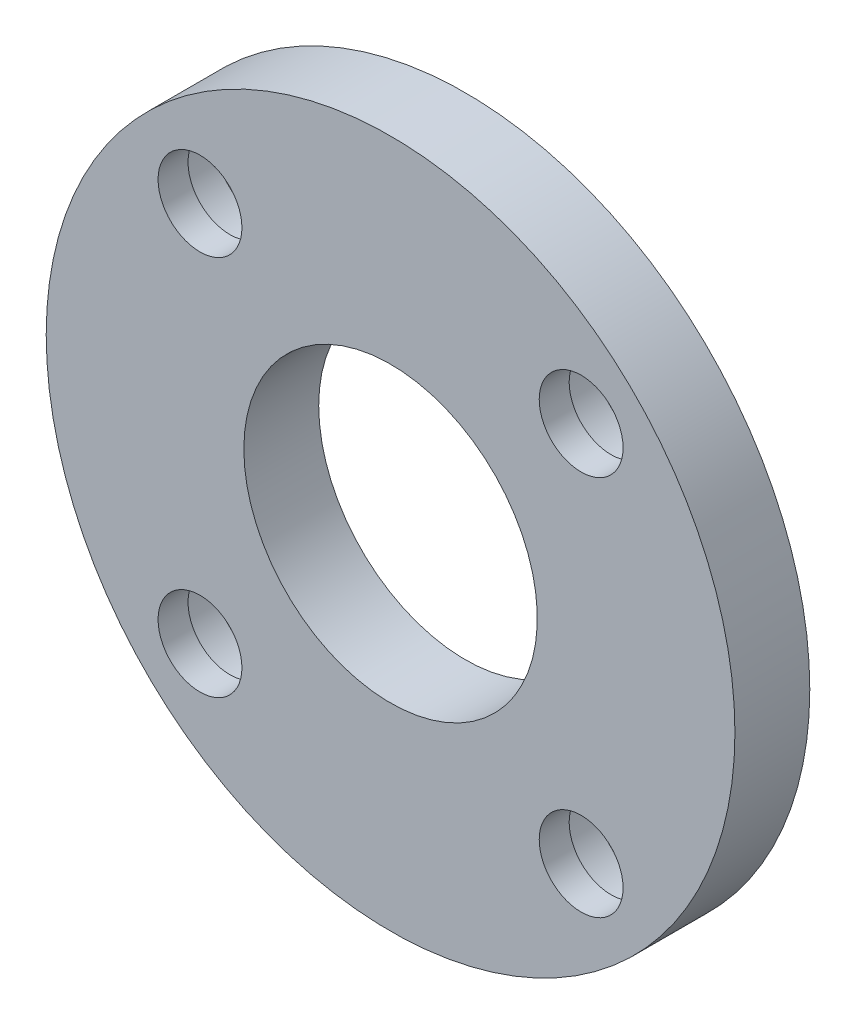
from build123d import *

# Parameters (mm, degrees)
SCHIZZO2_R                   = 23
SCHIZZO2_R_2                 = 2.8
ESTRUSIONE_ESTRUSIONE3_DEPTH = 5
SCHIZZO5_R                   = 4.3
TAGLIO_ESTRUSIONE1_DEPTH     = 3
SCHIZZO6_R                   = 9.8
TAGLIO_ESTRUSIONE2_DEPTH     = 33.908965344


with BuildPart() as part:
    # Schizzo2 → Estrusione-Estrusione3 (new body)
    with BuildSketch(Plane.XY):
        Circle(SCHIZZO2_R)
        with Locations((-12.727922061, 12.727922061)):
            Circle(SCHIZZO2_R_2, mode=Mode.SUBTRACT)
        with Locations((12.727922061, 12.727922061)):
            Circle(SCHIZZO2_R_2, mode=Mode.SUBTRACT)
        with Locations((12.727922061, -12.727922061)):
            Circle(SCHIZZO2_R_2, mode=Mode.SUBTRACT)
        with Locations((-12.727922061, -12.727922061)):
            Circle(SCHIZZO2_R_2, mode=Mode.SUBTRACT)
    extrude(amount=ESTRUSIONE_ESTRUSIONE3_DEPTH)

    # Schizzo5 → Taglio-Estrusione1 (cut)
    with BuildSketch(Plane(origin=(0, 0, 0), x_dir=(-1, 0, 0), z_dir=(0, 0, -1))):
        with Locations((-12.727922061, 12.727922061)):
            Circle(SCHIZZO5_R)
        with Locations((12.758824691, 12.727922061)):
            Circle(SCHIZZO5_R)
        with Locations((12.727922061, -12.727922061)):
            Circle(SCHIZZO5_R)
        with Locations((-12.727922061, -12.727922061)):
            Circle(SCHIZZO5_R)
    extrude(amount=-TAGLIO_ESTRUSIONE1_DEPTH, mode=Mode.SUBTRACT)

    # Schizzo6 → Taglio-Estrusione2 (cut, through all)
    with BuildSketch(Plane(origin=(0, 0, 0), x_dir=(-1, 0, 0), z_dir=(0, 0, -1))):
        Circle(SCHIZZO6_R)
    extrude(amount=-TAGLIO_ESTRUSIONE2_DEPTH, mode=Mode.SUBTRACT)


solid = part.part
